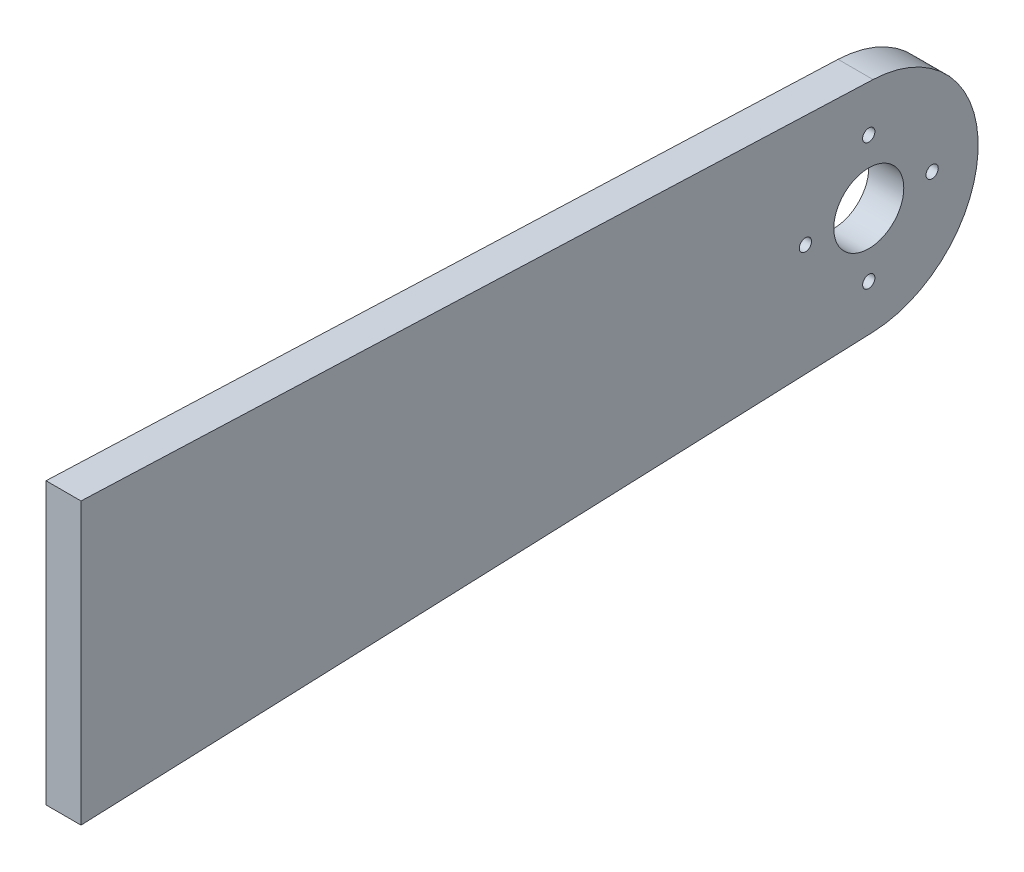
from build123d import *

# Parameters (mm, degrees)
SKETCH1_R           = 4
SKETCH1_R_2         = 0.7
BOSS_EXTRUDE1_DEPTH = 4


with BuildPart() as part:
    # Sketch1 → Boss-Extrude1 (new body)
    with BuildSketch(Plane(origin=(0, 0, 0), x_dir=(0, 0, -1), z_dir=(1, 0, 0))):
        with BuildLine():
            Line((-90, 16.039145957), (-90, -16.039145957))
            Line((-90, -16.039145957), (0.489836976, -12.490398702))
            ThreePointArc((0.489836976, -12.490398702), (12.5, 0), (0.489836976, 12.490398702))
            Line((0.489836976, 12.490398702), (-90, 16.039145957))
        make_face()
        Circle(SKETCH1_R, mode=Mode.SUBTRACT)
        with Locations((-7.24, 0)):
            Circle(SKETCH1_R_2, mode=Mode.SUBTRACT)
        with Locations((0, 7.24)):
            Circle(SKETCH1_R_2, mode=Mode.SUBTRACT)
        with Locations((7.24, 0)):
            Circle(SKETCH1_R_2, mode=Mode.SUBTRACT)
        with Locations((0, -7.24)):
            Circle(SKETCH1_R_2, mode=Mode.SUBTRACT)
    extrude(amount=BOSS_EXTRUDE1_DEPTH)


solid = part.part
